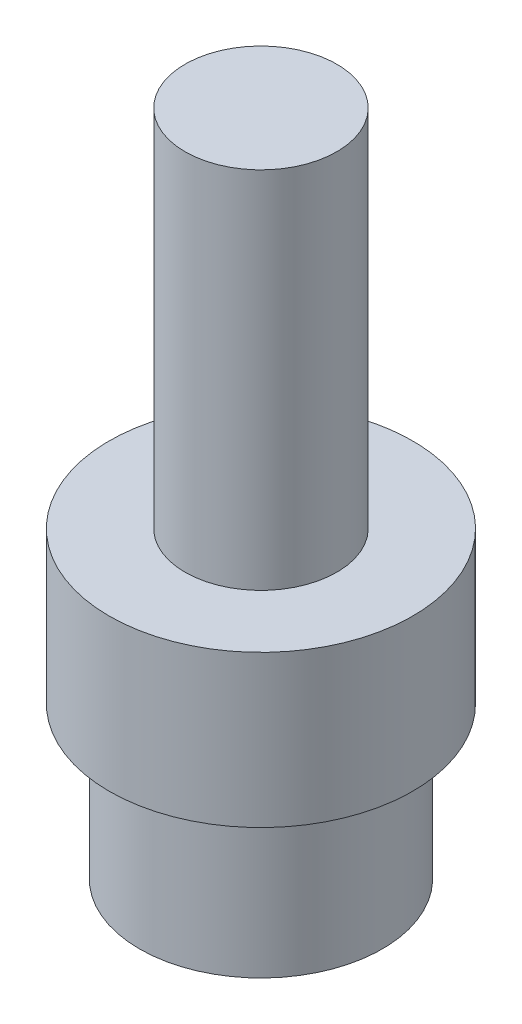
from build123d import *

# Parameters (mm, degrees)
SKETCH1_R           = 5
BOSS_EXTRUDE1_DEPTH = 5
SKETCH2_R           = 4
BOSS_EXTRUDE2_DEPTH = 5
SKETCH3_R           = 2.5
BOSS_EXTRUDE3_DEPTH = 12


with BuildPart() as part:
    # Sketch1 → Boss-Extrude1 (new body)
    with BuildSketch(Plane(origin=(0, 0, 0), x_dir=(1, 0, 0), z_dir=(0, 1, 0))):
        with Locations(Location((0, 0, 0), (0, 0, 270))):
            Circle(SKETCH1_R)
    extrude(amount=BOSS_EXTRUDE1_DEPTH)

    # Sketch2 → Boss-Extrude2 (add)
    with BuildSketch(Plane.XZ):
        with Locations(Location((0, 0, 0), (0, 0, 270))):
            Circle(SKETCH2_R)
    extrude(amount=BOSS_EXTRUDE2_DEPTH)

    # Sketch3 → Boss-Extrude3 (add)
    with BuildSketch(Plane(origin=(0, 5, 0), x_dir=(1, 0, 0), z_dir=(0, 1, 0))):
        with Locations(Location((0, 0, 0), (0, 0, 270))):
            Circle(SKETCH3_R)
    extrude(amount=BOSS_EXTRUDE3_DEPTH)


solid = part.part
